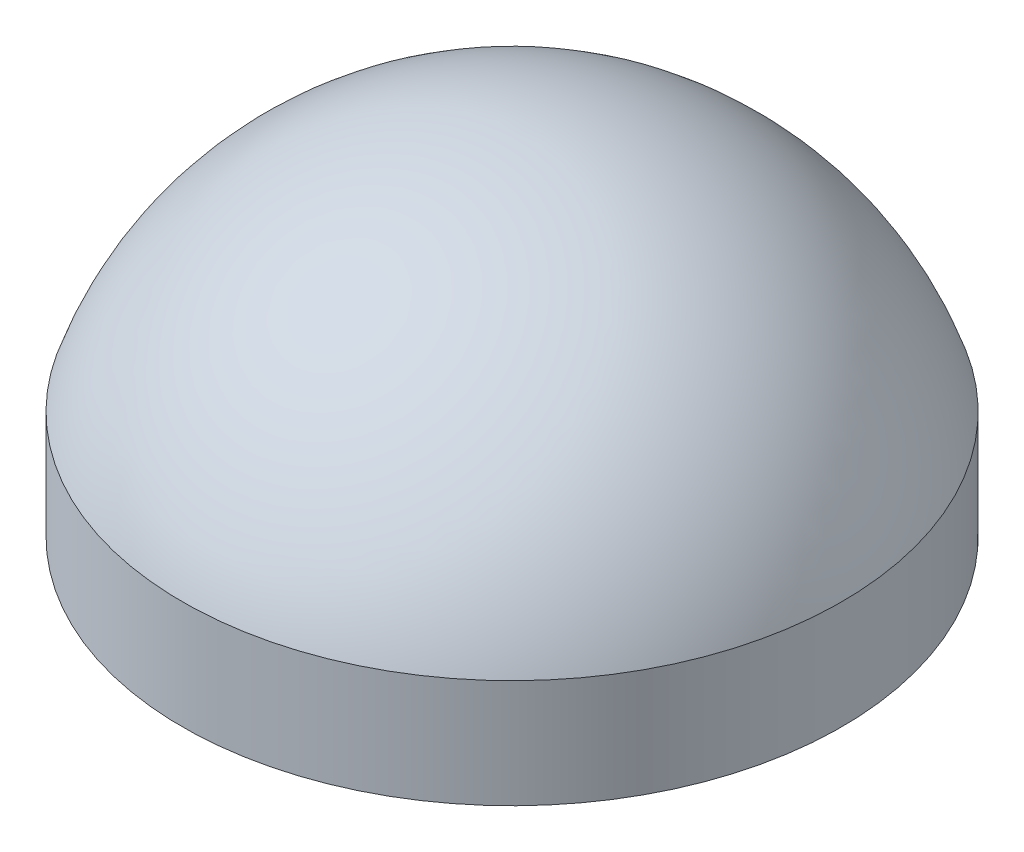
from build123d import *

# Parameters (mm, degrees)
REVOLVE1_ANGLE = 180
SKETCH2_W      = 2.135
SKETCH2_H      = 6.25


with BuildPart() as part:
    # Sketch1 → Revolve1 (revolve)
    with BuildSketch(Plane(origin=(0, 0, 0), x_dir=(1, 0, 0), z_dir=(0, 1, 0))):
        with BuildLine():
            Line((-13, 0), (-20, 0))
            ThreePointArc((-20, 0), (0, 20), (20, 0))
            Line((20, 0), (13, 0))
            ThreePointArc((13, 0), (0, 13), (-13, 0))
        make_face()
    revolve(axis=Axis((13, 0, 0), (1, 0, 0)), revolution_arc=REVOLVE1_ANGLE)

    # Sketch2 → Cut-Revolve1 (revolve, cut)
    with BuildSketch(Plane(origin=(0, 0, 0), x_dir=(0, 0, -1), z_dir=(1, 0, 0)), mode=Mode.PRIVATE) as cut_revolve1_sk:
        with Locations((-20.0675, 3.125)):
            Rectangle(SKETCH2_W, SKETCH2_H)
    revolve(cut_revolve1_sk.sketch.rotate(Axis((0, 0, 0), (0, 1, 0)), 180), axis=Axis((0, 0, 0), (0, 1, 0)), mode=Mode.SUBTRACT)


solid = part.part
